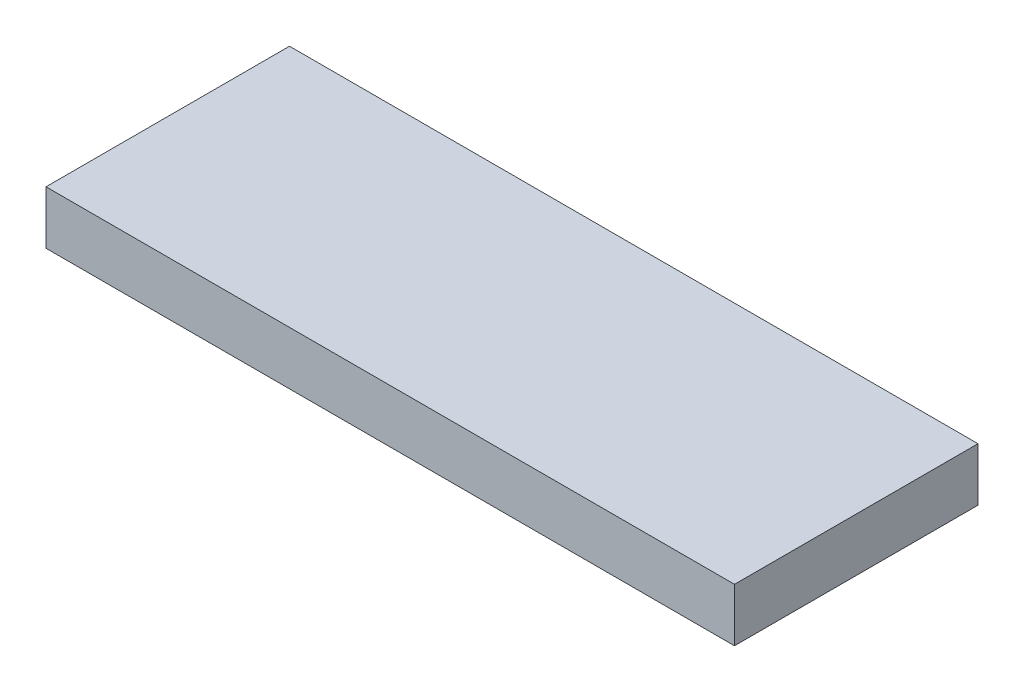
from build123d import *

# Parameters (mm, degrees)
SKETCH1_W           = 574.548
SKETCH1_H           = 203.2
BOSS_EXTRUDE1_DEPTH = 44.45


with BuildPart() as part:
    # Sketch1 → Boss-Extrude1 (new body)
    with BuildSketch(Plane(origin=(0, 0, 0), x_dir=(1, 0, 0), z_dir=(0, 1, 0))):
        with Locations((287.274, 101.6)):
            Rectangle(SKETCH1_W, SKETCH1_H)
    extrude(amount=BOSS_EXTRUDE1_DEPTH)


solid = part.part
